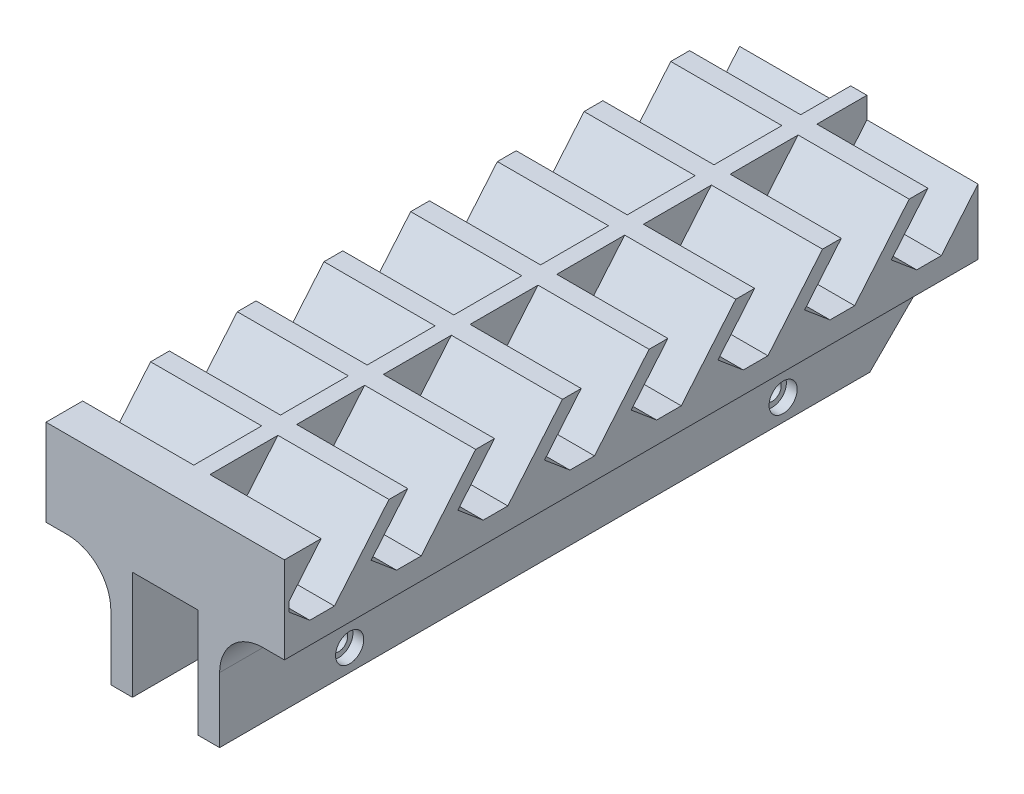
from build123d import *

# Parameters (mm, degrees)
BOSS_EXTRUDE1_DEPTH              = 101.6
F_10_CLEARANCE_HOLE1_D           = 5.207
SKETCH8_W                        = 69.85
SKETCH8_H                        = 203.2
BOSS_EXTRUDE4_DEPTH              = 6.35
SKETCH9_W                        = 203.2
SKETCH9_H                        = 19.05
BOSS_EXTRUDE5_DEPTH              = 2.38125
SKETCH13_R                       = 4.1275
CUT_EXTRUDE1_DEPTH               = 3.175
FILLET3_R                        = 12.7
F_1_4_0_25_DIAMETER_HOLE1_D      = 6.35
F_1_4_0_25_DIAMETER_HOLE1_DEPTH  = 11.938
F_1_4_0_25_DIAMETER_HOLE1_TIP    = 1.907732465
BOSS_EXTRUDE13_REACH             = 117.091
BOSS_EXTRUDE13_DIRECTION_2_REACH = 117.091
CHAMFER2_SIZE                    = 12.7


with BuildPart() as part:
    # Sketch1 → Boss-Extrude1 (new, symmetric)
    with BuildSketch(Plane.XY):
        Polygon((-15.9385, 22.225), (15.9385, 22.225), (15.9385, -15.875), (9.5885, -15.875), (9.5885, 15.875), (-9.5885, 15.875), (-9.5885, -15.875), (-15.9385, -15.875), align=None)
    extrude(amount=BOSS_EXTRUDE1_DEPTH, both=True)

    # #10 Clearance Hole1 (through all)
    with Locations(Plane(origin=(15.9385, 0, 0), x_dir=(0, 0, -1), z_dir=(1, 0, 0))):
        with Locations((-63.5, -9.525), (63.5, -9.525)):
            Hole(F_10_CLEARANCE_HOLE1_D / 2)

    # Sketch8 → Boss-Extrude4 (add)
    with BuildSketch(Plane(origin=(0, 22.225, 0), x_dir=(1, 0, 0), z_dir=(0, 1, 0))):
        Rectangle(SKETCH8_W, SKETCH8_H)
    extrude(amount=-BOSS_EXTRUDE4_DEPTH)

    # Sketch9 → Boss-Extrude5 (add, symmetric)
    with BuildSketch(Plane(origin=(0, 0, 0), x_dir=(0, 0, -1), z_dir=(1, 0, 0))):
        with Locations((0, 31.75)):
            Rectangle(SKETCH9_W, SKETCH9_H)
    extrude(amount=BOSS_EXTRUDE5_DEPTH, both=True)

    # Sketch13 → Cut-Extrude1 (cut)
    with BuildSketch(Plane(origin=(15.9385, 0, 0), x_dir=(0, 0, -1), z_dir=(1, 0, 0))):
        with Locations(Location((-63.5, -9.525, 0), (0, 0, 90))):
            Circle(SKETCH13_R)
        with Locations(Location((63.5, -9.525, 0), (0, 0, 90))):
            Circle(SKETCH13_R)
    extrude(amount=-CUT_EXTRUDE1_DEPTH, mode=Mode.SUBTRACT)

    # Fillet3
    fillet3_edges = [part.edges().sort_by_distance(p)[0] for p in [
        (15.9385, 15.875, 0),
        (-15.9385, 15.875, 0),
    ]]
    fillet(fillet3_edges, radius=FILLET3_R)

    # 1/4 (0.25) Diameter Hole1
    with Locations(Plane(origin=(2.38125, 0, 0), x_dir=(0, 0, -1), z_dir=(1, 0, 0))):
        with Locations((88.9, 31.75), (-88.9, 31.75), (-63.5, 31.75), (-38.1, 31.75), (-12.7, 31.75), (12.7, 31.75), (38.1, 31.75), (63.5, 31.75)):
            Hole(F_1_4_0_25_DIAMETER_HOLE1_D / 2, depth=F_1_4_0_25_DIAMETER_HOLE1_DEPTH)
            with Locations((0, 0, -(F_1_4_0_25_DIAMETER_HOLE1_DEPTH + F_1_4_0_25_DIAMETER_HOLE1_TIP / 2))):  # 118° drill point
                Cone(0, F_1_4_0_25_DIAMETER_HOLE1_D / 2, F_1_4_0_25_DIAMETER_HOLE1_TIP, mode=Mode.SUBTRACT)

    # Boss-Extrude13: up to this face of the body (flat: up to its plane)
    boss_extrude13_end = Plane(part.part.faces().sort_by_distance((34.925, 19.05, 0))[0])
    # Sketch16 → Boss-Extrude13 (add, up to the picked face)
    with BuildSketch(Plane(origin=(0, 0, 0), x_dir=(0, 0, -1), z_dir=(1, 0, 0)), mode=Mode.PRIVATE) as boss_extrude13_sk1:
        Polygon((-100.33, 29.982871997), (-90.854779558, 41.275), (-101.6, 41.275), (-101.6, 28.469344935), align=None)
    boss_extrude13_tool1 = split(extrude(boss_extrude13_sk1.sketch, amount=BOSS_EXTRUDE13_REACH, mode=Mode.PRIVATE), bisect_by=boss_extrude13_end, keep=Keep.BOTH, mode=Mode.PRIVATE)
    # Sketch16 → Boss-Extrude13 (add, up to the picked face)
    with BuildSketch(Plane(origin=(0, 0, 0), x_dir=(0, 0, -1), z_dir=(1, 0, 0)), mode=Mode.PRIVATE) as boss_extrude13_sk2:
        Polygon((-101.6, 28.469344935), (-100.33, 27.403688403), (-100.33, 29.982871997), align=None)
    boss_extrude13_tool2 = split(extrude(boss_extrude13_sk2.sketch, amount=BOSS_EXTRUDE13_REACH, mode=Mode.PRIVATE), bisect_by=boss_extrude13_end, keep=Keep.BOTH, mode=Mode.PRIVATE)
    # Sketch16 → Boss-Extrude13 (add, up to the picked face)
    with BuildSketch(Plane(origin=(0, 0, 0), x_dir=(0, 0, -1), z_dir=(1, 0, 0)), mode=Mode.PRIVATE) as boss_extrude13_sk3:
        Polygon((-101.6, 22.225), (-94.158279491, 22.225), (-100.33, 27.403688403), (-101.6, 28.469344935), align=None)
    boss_extrude13_tool3 = split(extrude(boss_extrude13_sk3.sketch, amount=BOSS_EXTRUDE13_REACH, mode=Mode.PRIVATE), bisect_by=boss_extrude13_end, keep=Keep.BOTH, mode=Mode.PRIVATE)
    # Sketch16 → Boss-Extrude13 (add, up to the picked face)
    with BuildSketch(Plane(origin=(0, 0, 0), x_dir=(0, 0, -1), z_dir=(1, 0, 0)), mode=Mode.PRIVATE) as boss_extrude13_sk4:
        Polygon((-70.960372468, 41.275), (-86.945220442, 22.225), (-81.439627532, 22.225), (-76.2, 28.469344935), (-65.454779558, 41.275), align=None)
    boss_extrude13_tool4 = split(extrude(boss_extrude13_sk4.sketch, amount=BOSS_EXTRUDE13_REACH, mode=Mode.PRIVATE), bisect_by=boss_extrude13_end, keep=Keep.BOTH, mode=Mode.PRIVATE)
    # Sketch16 → Boss-Extrude13 (add, up to the picked face)
    with BuildSketch(Plane(origin=(0, 0, 0), x_dir=(0, 0, -1), z_dir=(1, 0, 0)), mode=Mode.PRIVATE) as boss_extrude13_sk5:
        Polygon((-76.2, 28.469344935), (-81.439627532, 22.225), (-68.758279491, 22.225), align=None)
    boss_extrude13_tool5 = split(extrude(boss_extrude13_sk5.sketch, amount=BOSS_EXTRUDE13_REACH, mode=Mode.PRIVATE), bisect_by=boss_extrude13_end, keep=Keep.BOTH, mode=Mode.PRIVATE)
    # Sketch16 → Boss-Extrude13 (add, up to the picked face)
    with BuildSketch(Plane(origin=(0, 0, 0), x_dir=(0, 0, -1), z_dir=(1, 0, 0)), mode=Mode.PRIVATE) as boss_extrude13_sk6:
        Polygon((-40.054779558, 41.275), (-45.560372468, 41.275), (-61.545220442, 22.225), (-56.039627532, 22.225), (-50.8, 28.469344935), align=None)
    boss_extrude13_tool6 = split(extrude(boss_extrude13_sk6.sketch, amount=BOSS_EXTRUDE13_REACH, mode=Mode.PRIVATE), bisect_by=boss_extrude13_end, keep=Keep.BOTH, mode=Mode.PRIVATE)
    # Sketch16 → Boss-Extrude13 (add, up to the picked face)
    with BuildSketch(Plane(origin=(0, 0, 0), x_dir=(0, 0, -1), z_dir=(1, 0, 0)), mode=Mode.PRIVATE) as boss_extrude13_sk7:
        Polygon((-50.8, 28.469344935), (-56.039627532, 22.225), (-43.358279491, 22.225), align=None)
    boss_extrude13_tool7 = split(extrude(boss_extrude13_sk7.sketch, amount=BOSS_EXTRUDE13_REACH, mode=Mode.PRIVATE), bisect_by=boss_extrude13_end, keep=Keep.BOTH, mode=Mode.PRIVATE)
    # Sketch16 → Boss-Extrude13 (add, up to the picked face)
    with BuildSketch(Plane(origin=(0, 0, 0), x_dir=(0, 0, -1), z_dir=(1, 0, 0)), mode=Mode.PRIVATE) as boss_extrude13_sk8:
        Polygon((-14.654779558, 41.275), (-20.160372468, 41.275), (-36.145220442, 22.225), (-30.639627532, 22.225), (-25.4, 28.469344935), align=None)
    boss_extrude13_tool8 = split(extrude(boss_extrude13_sk8.sketch, amount=BOSS_EXTRUDE13_REACH, mode=Mode.PRIVATE), bisect_by=boss_extrude13_end, keep=Keep.BOTH, mode=Mode.PRIVATE)
    # Sketch16 → Boss-Extrude13 (add, up to the picked face)
    with BuildSketch(Plane(origin=(0, 0, 0), x_dir=(0, 0, -1), z_dir=(1, 0, 0)), mode=Mode.PRIVATE) as boss_extrude13_sk9:
        Polygon((-17.958279491, 22.225), (-25.4, 28.469344935), (-30.639627532, 22.225), align=None)
    boss_extrude13_tool9 = split(extrude(boss_extrude13_sk9.sketch, amount=BOSS_EXTRUDE13_REACH, mode=Mode.PRIVATE), bisect_by=boss_extrude13_end, keep=Keep.BOTH, mode=Mode.PRIVATE)
    # Sketch16 → Boss-Extrude13 (add, up to the picked face)
    with BuildSketch(Plane(origin=(0, 0, 0), x_dir=(0, 0, -1), z_dir=(1, 0, 0)), mode=Mode.PRIVATE) as boss_extrude13_sk10:
        Polygon((10.745220442, 41.275), (5.239627532, 41.275), (-10.745220442, 22.225), (-5.239627532, 22.225), (0, 28.469344935), align=None)
    boss_extrude13_tool10 = split(extrude(boss_extrude13_sk10.sketch, amount=BOSS_EXTRUDE13_REACH, mode=Mode.PRIVATE), bisect_by=boss_extrude13_end, keep=Keep.BOTH, mode=Mode.PRIVATE)
    # Sketch16 → Boss-Extrude13 (add, up to the picked face)
    with BuildSketch(Plane(origin=(0, 0, 0), x_dir=(0, 0, -1), z_dir=(1, 0, 0)), mode=Mode.PRIVATE) as boss_extrude13_sk11:
        Polygon((7.441720509, 22.225), (0, 28.469344935), (-5.239627532, 22.225), align=None)
    boss_extrude13_tool11 = split(extrude(boss_extrude13_sk11.sketch, amount=BOSS_EXTRUDE13_REACH, mode=Mode.PRIVATE), bisect_by=boss_extrude13_end, keep=Keep.BOTH, mode=Mode.PRIVATE)
    # Sketch16 → Boss-Extrude13 (add, up to the picked face)
    with BuildSketch(Plane(origin=(0, 0, 0), x_dir=(0, 0, -1), z_dir=(1, 0, 0)), mode=Mode.PRIVATE) as boss_extrude13_sk12:
        Polygon((36.145220442, 41.275), (30.639627532, 41.275), (14.654779558, 22.225), (20.160372468, 22.225), (25.4, 28.469344935), align=None)
    boss_extrude13_tool12 = split(extrude(boss_extrude13_sk12.sketch, amount=BOSS_EXTRUDE13_REACH, mode=Mode.PRIVATE), bisect_by=boss_extrude13_end, keep=Keep.BOTH, mode=Mode.PRIVATE)
    # Sketch16 → Boss-Extrude13 (add, up to the picked face)
    with BuildSketch(Plane(origin=(0, 0, 0), x_dir=(0, 0, -1), z_dir=(1, 0, 0)), mode=Mode.PRIVATE) as boss_extrude13_sk13:
        Polygon((32.841720509, 22.225), (25.4, 28.469344935), (20.160372468, 22.225), align=None)
    boss_extrude13_tool13 = split(extrude(boss_extrude13_sk13.sketch, amount=BOSS_EXTRUDE13_REACH, mode=Mode.PRIVATE), bisect_by=boss_extrude13_end, keep=Keep.BOTH, mode=Mode.PRIVATE)
    # Sketch16 → Boss-Extrude13 (add, up to the picked face)
    with BuildSketch(Plane(origin=(0, 0, 0), x_dir=(0, 0, -1), z_dir=(1, 0, 0)), mode=Mode.PRIVATE) as boss_extrude13_sk14:
        Polygon((61.545220442, 41.275), (56.039627532, 41.275), (40.054779558, 22.225), (45.560372468, 22.225), (50.8, 28.469344935), align=None)
    boss_extrude13_tool14 = split(extrude(boss_extrude13_sk14.sketch, amount=BOSS_EXTRUDE13_REACH, mode=Mode.PRIVATE), bisect_by=boss_extrude13_end, keep=Keep.BOTH, mode=Mode.PRIVATE)
    # Sketch16 → Boss-Extrude13 (add, up to the picked face)
    with BuildSketch(Plane(origin=(0, 0, 0), x_dir=(0, 0, -1), z_dir=(1, 0, 0)), mode=Mode.PRIVATE) as boss_extrude13_sk15:
        Polygon((58.241720509, 22.225), (50.8, 28.469344935), (45.560372468, 22.225), align=None)
    boss_extrude13_tool15 = split(extrude(boss_extrude13_sk15.sketch, amount=BOSS_EXTRUDE13_REACH, mode=Mode.PRIVATE), bisect_by=boss_extrude13_end, keep=Keep.BOTH, mode=Mode.PRIVATE)
    # Sketch16 → Boss-Extrude13 (add, up to the picked face)
    with BuildSketch(Plane(origin=(0, 0, 0), x_dir=(0, 0, -1), z_dir=(1, 0, 0)), mode=Mode.PRIVATE) as boss_extrude13_sk16:
        Polygon((86.945220442, 41.275), (81.439627532, 41.275), (65.454779558, 22.225), (70.960372468, 22.225), (76.2, 28.469344935), align=None)
    boss_extrude13_tool16 = split(extrude(boss_extrude13_sk16.sketch, amount=BOSS_EXTRUDE13_REACH, mode=Mode.PRIVATE), bisect_by=boss_extrude13_end, keep=Keep.BOTH, mode=Mode.PRIVATE)
    # Sketch16 → Boss-Extrude13 (add, up to the picked face)
    with BuildSketch(Plane(origin=(0, 0, 0), x_dir=(0, 0, -1), z_dir=(1, 0, 0)), mode=Mode.PRIVATE) as boss_extrude13_sk17:
        Polygon((83.641720509, 22.225), (76.2, 28.469344935), (70.960372468, 22.225), align=None)
    boss_extrude13_tool17 = split(extrude(boss_extrude13_sk17.sketch, amount=BOSS_EXTRUDE13_REACH, mode=Mode.PRIVATE), bisect_by=boss_extrude13_end, keep=Keep.BOTH, mode=Mode.PRIVATE)
    # Sketch16 → Boss-Extrude13 (add, up to the picked face)
    with BuildSketch(Plane(origin=(0, 0, 0), x_dir=(0, 0, -1), z_dir=(1, 0, 0)), mode=Mode.PRIVATE) as boss_extrude13_sk18:
        Polygon((101.6, 28.469344935), (101.6, 35.030655065), (90.854779558, 22.225), (96.360372468, 22.225), align=None)
    boss_extrude13_tool18 = split(extrude(boss_extrude13_sk18.sketch, amount=BOSS_EXTRUDE13_REACH, mode=Mode.PRIVATE), bisect_by=boss_extrude13_end, keep=Keep.BOTH, mode=Mode.PRIVATE)
    # Sketch16 → Boss-Extrude13 (add, up to the picked face)
    with BuildSketch(Plane(origin=(0, 0, 0), x_dir=(0, 0, -1), z_dir=(1, 0, 0)), mode=Mode.PRIVATE) as boss_extrude13_sk19:
        Polygon((101.6, 22.225), (101.6, 28.469344935), (96.360372468, 22.225), align=None)
    boss_extrude13_tool19 = split(extrude(boss_extrude13_sk19.sketch, amount=BOSS_EXTRUDE13_REACH, mode=Mode.PRIVATE), bisect_by=boss_extrude13_end, keep=Keep.BOTH, mode=Mode.PRIVATE)
    add(boss_extrude13_tool1.solids().sort_by(Axis((0, 37.006448, 98.01826), (1, 0, 0)))[0])
    add(boss_extrude13_tool2.solids().sort_by(Axis((0, 28.618635, 100.753333), (1, 0, 0)))[0])
    add(boss_extrude13_tool3.solids().sort_by(Axis((0, 24.306448, 99.119426), (1, 0, 0)))[0])
    add(boss_extrude13_tool4.solids().sort_by(Axis((0, 31.75, 76.2), (1, 0, 0)))[0])
    add(boss_extrude13_tool5.solids().sort_by(Axis((0, 24.306448, 75.465969), (1, 0, 0)))[0])
    add(boss_extrude13_tool6.solids().sort_by(Axis((0, 31.75, 50.8), (1, 0, 0)))[0])
    add(boss_extrude13_tool7.solids().sort_by(Axis((0, 24.306448, 50.065969), (1, 0, 0)))[0])
    add(boss_extrude13_tool8.solids().sort_by(Axis((0, 31.75, 25.4), (1, 0, 0)))[0])
    add(boss_extrude13_tool9.solids().sort_by(Axis((0, 24.306448, 24.665969), (1, 0, 0)))[0])
    add(boss_extrude13_tool10.solids().sort_by(Axis((0, 31.75, 0), (1, 0, 0)))[0])
    add(boss_extrude13_tool11.solids().sort_by(Axis((0, 24.306448, -0.734031), (1, 0, 0)))[0])
    add(boss_extrude13_tool12.solids().sort_by(Axis((0, 31.75, -25.4), (1, 0, 0)))[0])
    add(boss_extrude13_tool13.solids().sort_by(Axis((0, 24.306448, -26.134031), (1, 0, 0)))[0])
    add(boss_extrude13_tool14.solids().sort_by(Axis((0, 31.75, -50.8), (1, 0, 0)))[0])
    add(boss_extrude13_tool15.solids().sort_by(Axis((0, 24.306448, -51.534031), (1, 0, 0)))[0])
    add(boss_extrude13_tool16.solids().sort_by(Axis((0, 31.75, -76.2), (1, 0, 0)))[0])
    add(boss_extrude13_tool17.solids().sort_by(Axis((0, 24.306448, -76.934031), (1, 0, 0)))[0])
    add(boss_extrude13_tool18.solids().sort_by(Axis((0, 27.175824, -97.445766), (1, 0, 0)))[0])
    add(boss_extrude13_tool19.solids().sort_by(Axis((0, 24.306448, -99.853457), (1, 0, 0)))[0])

    # Boss-Extrude13 direction 2: up to this face of the body (flat: up to its plane)
    boss_extrude13_direction_2_end = Plane(part.part.faces().sort_by_distance((-34.925, 19.05, 0))[0])
    # Sketch16 → Boss-Extrude13 direction 2 (add, up to the picked face)
    with BuildSketch(Plane(origin=(0, 0, 0), x_dir=(0, 0, -1), z_dir=(1, 0, 0)), mode=Mode.PRIVATE) as boss_extrude13_direction_2_sk1:
        Polygon((-100.33, 29.982871997), (-90.854779558, 41.275), (-101.6, 41.275), (-101.6, 28.469344935), align=None)
    boss_extrude13_direction_2_tool1 = split(extrude(boss_extrude13_direction_2_sk1.sketch, amount=-BOSS_EXTRUDE13_DIRECTION_2_REACH, mode=Mode.PRIVATE), bisect_by=boss_extrude13_direction_2_end, keep=Keep.BOTH, mode=Mode.PRIVATE)
    # Sketch16 → Boss-Extrude13 direction 2 (add, up to the picked face)
    with BuildSketch(Plane(origin=(0, 0, 0), x_dir=(0, 0, -1), z_dir=(1, 0, 0)), mode=Mode.PRIVATE) as boss_extrude13_direction_2_sk2:
        Polygon((-101.6, 28.469344935), (-100.33, 27.403688403), (-100.33, 29.982871997), align=None)
    boss_extrude13_direction_2_tool2 = split(extrude(boss_extrude13_direction_2_sk2.sketch, amount=-BOSS_EXTRUDE13_DIRECTION_2_REACH, mode=Mode.PRIVATE), bisect_by=boss_extrude13_direction_2_end, keep=Keep.BOTH, mode=Mode.PRIVATE)
    # Sketch16 → Boss-Extrude13 direction 2 (add, up to the picked face)
    with BuildSketch(Plane(origin=(0, 0, 0), x_dir=(0, 0, -1), z_dir=(1, 0, 0)), mode=Mode.PRIVATE) as boss_extrude13_direction_2_sk3:
        Polygon((-101.6, 22.225), (-94.158279491, 22.225), (-100.33, 27.403688403), (-101.6, 28.469344935), align=None)
    boss_extrude13_direction_2_tool3 = split(extrude(boss_extrude13_direction_2_sk3.sketch, amount=-BOSS_EXTRUDE13_DIRECTION_2_REACH, mode=Mode.PRIVATE), bisect_by=boss_extrude13_direction_2_end, keep=Keep.BOTH, mode=Mode.PRIVATE)
    # Sketch16 → Boss-Extrude13 direction 2 (add, up to the picked face)
    with BuildSketch(Plane(origin=(0, 0, 0), x_dir=(0, 0, -1), z_dir=(1, 0, 0)), mode=Mode.PRIVATE) as boss_extrude13_direction_2_sk4:
        Polygon((-70.960372468, 41.275), (-86.945220442, 22.225), (-81.439627532, 22.225), (-76.2, 28.469344935), (-65.454779558, 41.275), align=None)
    boss_extrude13_direction_2_tool4 = split(extrude(boss_extrude13_direction_2_sk4.sketch, amount=-BOSS_EXTRUDE13_DIRECTION_2_REACH, mode=Mode.PRIVATE), bisect_by=boss_extrude13_direction_2_end, keep=Keep.BOTH, mode=Mode.PRIVATE)
    # Sketch16 → Boss-Extrude13 direction 2 (add, up to the picked face)
    with BuildSketch(Plane(origin=(0, 0, 0), x_dir=(0, 0, -1), z_dir=(1, 0, 0)), mode=Mode.PRIVATE) as boss_extrude13_direction_2_sk5:
        Polygon((-76.2, 28.469344935), (-81.439627532, 22.225), (-68.758279491, 22.225), align=None)
    boss_extrude13_direction_2_tool5 = split(extrude(boss_extrude13_direction_2_sk5.sketch, amount=-BOSS_EXTRUDE13_DIRECTION_2_REACH, mode=Mode.PRIVATE), bisect_by=boss_extrude13_direction_2_end, keep=Keep.BOTH, mode=Mode.PRIVATE)
    # Sketch16 → Boss-Extrude13 direction 2 (add, up to the picked face)
    with BuildSketch(Plane(origin=(0, 0, 0), x_dir=(0, 0, -1), z_dir=(1, 0, 0)), mode=Mode.PRIVATE) as boss_extrude13_direction_2_sk6:
        Polygon((-40.054779558, 41.275), (-45.560372468, 41.275), (-61.545220442, 22.225), (-56.039627532, 22.225), (-50.8, 28.469344935), align=None)
    boss_extrude13_direction_2_tool6 = split(extrude(boss_extrude13_direction_2_sk6.sketch, amount=-BOSS_EXTRUDE13_DIRECTION_2_REACH, mode=Mode.PRIVATE), bisect_by=boss_extrude13_direction_2_end, keep=Keep.BOTH, mode=Mode.PRIVATE)
    # Sketch16 → Boss-Extrude13 direction 2 (add, up to the picked face)
    with BuildSketch(Plane(origin=(0, 0, 0), x_dir=(0, 0, -1), z_dir=(1, 0, 0)), mode=Mode.PRIVATE) as boss_extrude13_direction_2_sk7:
        Polygon((-50.8, 28.469344935), (-56.039627532, 22.225), (-43.358279491, 22.225), align=None)
    boss_extrude13_direction_2_tool7 = split(extrude(boss_extrude13_direction_2_sk7.sketch, amount=-BOSS_EXTRUDE13_DIRECTION_2_REACH, mode=Mode.PRIVATE), bisect_by=boss_extrude13_direction_2_end, keep=Keep.BOTH, mode=Mode.PRIVATE)
    # Sketch16 → Boss-Extrude13 direction 2 (add, up to the picked face)
    with BuildSketch(Plane(origin=(0, 0, 0), x_dir=(0, 0, -1), z_dir=(1, 0, 0)), mode=Mode.PRIVATE) as boss_extrude13_direction_2_sk8:
        Polygon((-14.654779558, 41.275), (-20.160372468, 41.275), (-36.145220442, 22.225), (-30.639627532, 22.225), (-25.4, 28.469344935), align=None)
    boss_extrude13_direction_2_tool8 = split(extrude(boss_extrude13_direction_2_sk8.sketch, amount=-BOSS_EXTRUDE13_DIRECTION_2_REACH, mode=Mode.PRIVATE), bisect_by=boss_extrude13_direction_2_end, keep=Keep.BOTH, mode=Mode.PRIVATE)
    # Sketch16 → Boss-Extrude13 direction 2 (add, up to the picked face)
    with BuildSketch(Plane(origin=(0, 0, 0), x_dir=(0, 0, -1), z_dir=(1, 0, 0)), mode=Mode.PRIVATE) as boss_extrude13_direction_2_sk9:
        Polygon((-17.958279491, 22.225), (-25.4, 28.469344935), (-30.639627532, 22.225), align=None)
    boss_extrude13_direction_2_tool9 = split(extrude(boss_extrude13_direction_2_sk9.sketch, amount=-BOSS_EXTRUDE13_DIRECTION_2_REACH, mode=Mode.PRIVATE), bisect_by=boss_extrude13_direction_2_end, keep=Keep.BOTH, mode=Mode.PRIVATE)
    # Sketch16 → Boss-Extrude13 direction 2 (add, up to the picked face)
    with BuildSketch(Plane(origin=(0, 0, 0), x_dir=(0, 0, -1), z_dir=(1, 0, 0)), mode=Mode.PRIVATE) as boss_extrude13_direction_2_sk10:
        Polygon((10.745220442, 41.275), (5.239627532, 41.275), (-10.745220442, 22.225), (-5.239627532, 22.225), (0, 28.469344935), align=None)
    boss_extrude13_direction_2_tool10 = split(extrude(boss_extrude13_direction_2_sk10.sketch, amount=-BOSS_EXTRUDE13_DIRECTION_2_REACH, mode=Mode.PRIVATE), bisect_by=boss_extrude13_direction_2_end, keep=Keep.BOTH, mode=Mode.PRIVATE)
    # Sketch16 → Boss-Extrude13 direction 2 (add, up to the picked face)
    with BuildSketch(Plane(origin=(0, 0, 0), x_dir=(0, 0, -1), z_dir=(1, 0, 0)), mode=Mode.PRIVATE) as boss_extrude13_direction_2_sk11:
        Polygon((7.441720509, 22.225), (0, 28.469344935), (-5.239627532, 22.225), align=None)
    boss_extrude13_direction_2_tool11 = split(extrude(boss_extrude13_direction_2_sk11.sketch, amount=-BOSS_EXTRUDE13_DIRECTION_2_REACH, mode=Mode.PRIVATE), bisect_by=boss_extrude13_direction_2_end, keep=Keep.BOTH, mode=Mode.PRIVATE)
    # Sketch16 → Boss-Extrude13 direction 2 (add, up to the picked face)
    with BuildSketch(Plane(origin=(0, 0, 0), x_dir=(0, 0, -1), z_dir=(1, 0, 0)), mode=Mode.PRIVATE) as boss_extrude13_direction_2_sk12:
        Polygon((36.145220442, 41.275), (30.639627532, 41.275), (14.654779558, 22.225), (20.160372468, 22.225), (25.4, 28.469344935), align=None)
    boss_extrude13_direction_2_tool12 = split(extrude(boss_extrude13_direction_2_sk12.sketch, amount=-BOSS_EXTRUDE13_DIRECTION_2_REACH, mode=Mode.PRIVATE), bisect_by=boss_extrude13_direction_2_end, keep=Keep.BOTH, mode=Mode.PRIVATE)
    # Sketch16 → Boss-Extrude13 direction 2 (add, up to the picked face)
    with BuildSketch(Plane(origin=(0, 0, 0), x_dir=(0, 0, -1), z_dir=(1, 0, 0)), mode=Mode.PRIVATE) as boss_extrude13_direction_2_sk13:
        Polygon((32.841720509, 22.225), (25.4, 28.469344935), (20.160372468, 22.225), align=None)
    boss_extrude13_direction_2_tool13 = split(extrude(boss_extrude13_direction_2_sk13.sketch, amount=-BOSS_EXTRUDE13_DIRECTION_2_REACH, mode=Mode.PRIVATE), bisect_by=boss_extrude13_direction_2_end, keep=Keep.BOTH, mode=Mode.PRIVATE)
    # Sketch16 → Boss-Extrude13 direction 2 (add, up to the picked face)
    with BuildSketch(Plane(origin=(0, 0, 0), x_dir=(0, 0, -1), z_dir=(1, 0, 0)), mode=Mode.PRIVATE) as boss_extrude13_direction_2_sk14:
        Polygon((61.545220442, 41.275), (56.039627532, 41.275), (40.054779558, 22.225), (45.560372468, 22.225), (50.8, 28.469344935), align=None)
    boss_extrude13_direction_2_tool14 = split(extrude(boss_extrude13_direction_2_sk14.sketch, amount=-BOSS_EXTRUDE13_DIRECTION_2_REACH, mode=Mode.PRIVATE), bisect_by=boss_extrude13_direction_2_end, keep=Keep.BOTH, mode=Mode.PRIVATE)
    # Sketch16 → Boss-Extrude13 direction 2 (add, up to the picked face)
    with BuildSketch(Plane(origin=(0, 0, 0), x_dir=(0, 0, -1), z_dir=(1, 0, 0)), mode=Mode.PRIVATE) as boss_extrude13_direction_2_sk15:
        Polygon((58.241720509, 22.225), (50.8, 28.469344935), (45.560372468, 22.225), align=None)
    boss_extrude13_direction_2_tool15 = split(extrude(boss_extrude13_direction_2_sk15.sketch, amount=-BOSS_EXTRUDE13_DIRECTION_2_REACH, mode=Mode.PRIVATE), bisect_by=boss_extrude13_direction_2_end, keep=Keep.BOTH, mode=Mode.PRIVATE)
    # Sketch16 → Boss-Extrude13 direction 2 (add, up to the picked face)
    with BuildSketch(Plane(origin=(0, 0, 0), x_dir=(0, 0, -1), z_dir=(1, 0, 0)), mode=Mode.PRIVATE) as boss_extrude13_direction_2_sk16:
        Polygon((86.945220442, 41.275), (81.439627532, 41.275), (65.454779558, 22.225), (70.960372468, 22.225), (76.2, 28.469344935), align=None)
    boss_extrude13_direction_2_tool16 = split(extrude(boss_extrude13_direction_2_sk16.sketch, amount=-BOSS_EXTRUDE13_DIRECTION_2_REACH, mode=Mode.PRIVATE), bisect_by=boss_extrude13_direction_2_end, keep=Keep.BOTH, mode=Mode.PRIVATE)
    # Sketch16 → Boss-Extrude13 direction 2 (add, up to the picked face)
    with BuildSketch(Plane(origin=(0, 0, 0), x_dir=(0, 0, -1), z_dir=(1, 0, 0)), mode=Mode.PRIVATE) as boss_extrude13_direction_2_sk17:
        Polygon((83.641720509, 22.225), (76.2, 28.469344935), (70.960372468, 22.225), align=None)
    boss_extrude13_direction_2_tool17 = split(extrude(boss_extrude13_direction_2_sk17.sketch, amount=-BOSS_EXTRUDE13_DIRECTION_2_REACH, mode=Mode.PRIVATE), bisect_by=boss_extrude13_direction_2_end, keep=Keep.BOTH, mode=Mode.PRIVATE)
    # Sketch16 → Boss-Extrude13 direction 2 (add, up to the picked face)
    with BuildSketch(Plane(origin=(0, 0, 0), x_dir=(0, 0, -1), z_dir=(1, 0, 0)), mode=Mode.PRIVATE) as boss_extrude13_direction_2_sk18:
        Polygon((101.6, 28.469344935), (101.6, 35.030655065), (90.854779558, 22.225), (96.360372468, 22.225), align=None)
    boss_extrude13_direction_2_tool18 = split(extrude(boss_extrude13_direction_2_sk18.sketch, amount=-BOSS_EXTRUDE13_DIRECTION_2_REACH, mode=Mode.PRIVATE), bisect_by=boss_extrude13_direction_2_end, keep=Keep.BOTH, mode=Mode.PRIVATE)
    # Sketch16 → Boss-Extrude13 direction 2 (add, up to the picked face)
    with BuildSketch(Plane(origin=(0, 0, 0), x_dir=(0, 0, -1), z_dir=(1, 0, 0)), mode=Mode.PRIVATE) as boss_extrude13_direction_2_sk19:
        Polygon((101.6, 22.225), (101.6, 28.469344935), (96.360372468, 22.225), align=None)
    boss_extrude13_direction_2_tool19 = split(extrude(boss_extrude13_direction_2_sk19.sketch, amount=-BOSS_EXTRUDE13_DIRECTION_2_REACH, mode=Mode.PRIVATE), bisect_by=boss_extrude13_direction_2_end, keep=Keep.BOTH, mode=Mode.PRIVATE)
    add(boss_extrude13_direction_2_tool1.solids().sort_by(Axis((0, 37.006448, 98.01826), (-1, 0, 0)))[0])
    add(boss_extrude13_direction_2_tool2.solids().sort_by(Axis((0, 28.618635, 100.753333), (-1, 0, 0)))[0])
    add(boss_extrude13_direction_2_tool3.solids().sort_by(Axis((0, 24.306448, 99.119426), (-1, 0, 0)))[0])
    add(boss_extrude13_direction_2_tool4.solids().sort_by(Axis((0, 31.75, 76.2), (-1, 0, 0)))[0])
    add(boss_extrude13_direction_2_tool5.solids().sort_by(Axis((0, 24.306448, 75.465969), (-1, 0, 0)))[0])
    add(boss_extrude13_direction_2_tool6.solids().sort_by(Axis((0, 31.75, 50.8), (-1, 0, 0)))[0])
    add(boss_extrude13_direction_2_tool7.solids().sort_by(Axis((0, 24.306448, 50.065969), (-1, 0, 0)))[0])
    add(boss_extrude13_direction_2_tool8.solids().sort_by(Axis((0, 31.75, 25.4), (-1, 0, 0)))[0])
    add(boss_extrude13_direction_2_tool9.solids().sort_by(Axis((0, 24.306448, 24.665969), (-1, 0, 0)))[0])
    add(boss_extrude13_direction_2_tool10.solids().sort_by(Axis((0, 31.75, 0), (-1, 0, 0)))[0])
    add(boss_extrude13_direction_2_tool11.solids().sort_by(Axis((0, 24.306448, -0.734031), (-1, 0, 0)))[0])
    add(boss_extrude13_direction_2_tool12.solids().sort_by(Axis((0, 31.75, -25.4), (-1, 0, 0)))[0])
    add(boss_extrude13_direction_2_tool13.solids().sort_by(Axis((0, 24.306448, -26.134031), (-1, 0, 0)))[0])
    add(boss_extrude13_direction_2_tool14.solids().sort_by(Axis((0, 31.75, -50.8), (-1, 0, 0)))[0])
    add(boss_extrude13_direction_2_tool15.solids().sort_by(Axis((0, 24.306448, -51.534031), (-1, 0, 0)))[0])
    add(boss_extrude13_direction_2_tool16.solids().sort_by(Axis((0, 31.75, -76.2), (-1, 0, 0)))[0])
    add(boss_extrude13_direction_2_tool17.solids().sort_by(Axis((0, 24.306448, -76.934031), (-1, 0, 0)))[0])
    add(boss_extrude13_direction_2_tool18.solids().sort_by(Axis((0, 27.175824, -97.445766), (-1, 0, 0)))[0])
    add(boss_extrude13_direction_2_tool19.solids().sort_by(Axis((0, 24.306448, -99.853457), (-1, 0, 0)))[0])

    # Chamfer2
    chamfer2_edges = [part.edges().sort_by_distance(p)[0] for p in [
        (12.7635, -15.875, -101.6),
        (-12.7635, -15.875, -101.6),
    ]]
    chamfer(chamfer2_edges, length=CHAMFER2_SIZE)


solid = part.part
